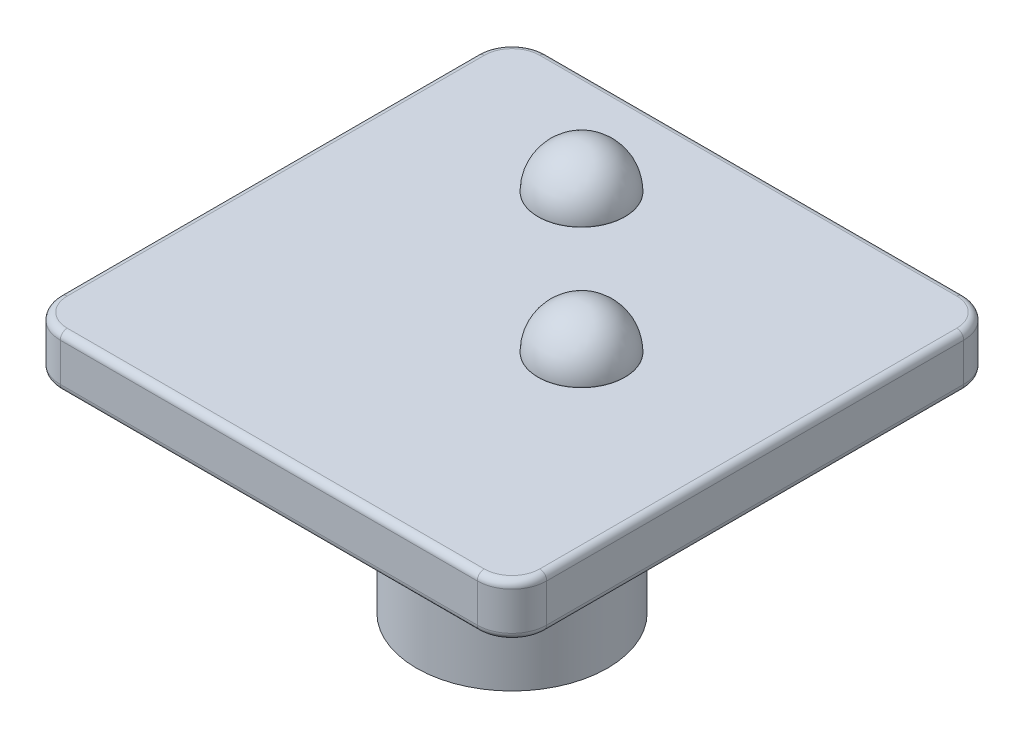
from build123d import *

# Parameters (mm, degrees)
BOSS_EXTRUDE1_DEPTH = 1.5
SKETCH2_R           = 2.75
BOSS_EXTRUDE2_DEPTH = 6
SKETCH3_W           = 1.1
SKETCH3_H           = 1.45
SKETCH3_W_2         = 1.45
SKETCH3_H_2         = 1.1
CUT_EXTRUDE1_DEPTH  = 6
CHAMFER1_SIZE       = 0.3
FILLET1_R           = 1
SKETCH4_R           = 1.25
BOSS_EXTRUDE3_DEPTH = 0.01
DOME1_FACE_RADIUS   = 1.25
DOME1_HEIGHT        = 1.25
DOME4_FACE_RADIUS   = 1.25
DOME4_HEIGHT        = 1.25
FILLET3_R           = 0.2


with BuildPart() as part:
    # Sketch1 → Boss-Extrude1 (new body)
    with BuildSketch(Plane(origin=(0, 0, 0), x_dir=(1, 0, 0), z_dir=(0, 1, 0))):
        with BuildLine():
            Line((-7.324675649, 4.396717546), (4.675324351, 4.396717546))
            ThreePointArc((4.675324351, 4.396717546), (5.382431132, 4.103824327), (5.675324351, 3.396717546))
            Line((5.675324351, 3.396717546), (5.675324351, -8.603282454))
            ThreePointArc((5.675324351, -8.603282454), (5.382431132, -9.310389235), (4.675324351, -9.603282454))
            Line((4.675324351, -9.603282454), (-7.324675649, -9.603282454))
            ThreePointArc((-7.324675649, -9.603282454), (-8.03178243, -9.310389235), (-8.324675649, -8.603282454))
            Line((-8.324675649, -8.603282454), (-8.324675649, 3.396717546))
            ThreePointArc((-8.324675649, 3.396717546), (-8.03178243, 4.103824327), (-7.324675649, 4.396717546))
        make_face()
    extrude(amount=BOSS_EXTRUDE1_DEPTH)

    # Sketch2 → Boss-Extrude2 (add)
    with BuildSketch(Plane.XZ):
        with Locations(Location((-1.324675649, 2.603282454, 0), (0, 0, 270))):
            Circle(SKETCH2_R)
    extrude(amount=BOSS_EXTRUDE2_DEPTH)

    # Sketch3 → Cut-Extrude1 (cut)
    with BuildSketch(Plane.XZ.offset(6)):
        with Locations((-1.324675649, 3.878282454)):
            Rectangle(SKETCH3_W, SKETCH3_H)
        with Locations((-0.049675649, 2.603282454)):
            Rectangle(SKETCH3_W_2, SKETCH3_H_2)
        with Locations((-1.324675649, 2.603282454)):
            Rectangle(SKETCH3_W, SKETCH3_H_2)
        with Locations((-2.599675649, 2.603282454)):
            Rectangle(SKETCH3_W_2, SKETCH3_H_2)
        with Locations((-1.324675649, 1.328282454)):
            Rectangle(SKETCH3_W, SKETCH3_H)
    extrude(amount=-CUT_EXTRUDE1_DEPTH, mode=Mode.SUBTRACT)

    # Chamfer1
    chamfer1_edges = [part.edges().sort_by_distance(p)[0] for p in [
        (-0.774675649, -6, 3.878282454),
        (-0.049675649, -6, 3.153282454),
        (0.675324351, -6, 2.603282454),
        (-0.774675649, -6, 1.328282454),
        (-2.599675649, -6, 3.153282454),
        (-1.324675649, -6, 4.603282454),
        (-1.874675649, -6, 3.878282454),
        (-3.324675649, -6, 2.603282454),
        (-2.599675649, -6, 2.053282454),
        (-1.874675649, -6, 1.328282454),
        (-1.324675649, -6, 0.603282454),
        (-0.049675649, -6, 2.053282454),
    ]]
    chamfer(chamfer1_edges, length=CHAMFER1_SIZE)

    # Fillet1
    fillet1_edges = [part.edges().sort_by_distance(p)[0] for p in [
        (-1.324675649, 0, 5.353282454),
    ]]
    fillet(fillet1_edges, radius=FILLET1_R)

    # Sketch4 → Boss-Extrude3 (add)
    with BuildSketch(Plane(origin=(0, 1.5, 0), x_dir=(1, 0, 0), z_dir=(0, 1, 0))):
        with Locations(Location((-3.324675649, 1.396717546, 0), (0, 0, 90))):
            Circle(SKETCH4_R)
        with Locations(Location((0.675324351, -2.603282454, 0), (0, 0, 90))):
            Circle(SKETCH4_R)
    extrude(amount=BOSS_EXTRUDE3_DEPTH)

    # Dome1: a dome of height H over a round flat face of radius A is a cap of a sphere of radius (A * A + H * H) / (2 * H)
    dome1_r = (DOME1_FACE_RADIUS * DOME1_FACE_RADIUS + DOME1_HEIGHT * DOME1_HEIGHT) / (2 * DOME1_HEIGHT)
    dome1_base = Plane((-3.324675649, 1.51, -1.396717546), z_dir=(0, 1, 0))
    with Locations(dome1_base.offset(DOME1_HEIGHT - dome1_r)):
        dome1_ball = Sphere(dome1_r, mode=Mode.PRIVATE)
    add(split(dome1_ball, bisect_by=dome1_base, keep=Keep.TOP, mode=Mode.PRIVATE))

    # Dome4: a dome of height H over a round flat face of radius A is a cap of a sphere of radius (A * A + H * H) / (2 * H)
    dome4_r = (DOME4_FACE_RADIUS * DOME4_FACE_RADIUS + DOME4_HEIGHT * DOME4_HEIGHT) / (2 * DOME4_HEIGHT)
    dome4_base = Plane((0.675324351, 1.51, 2.603282454), z_dir=(0, 1, 0))
    with Locations(dome4_base.offset(DOME4_HEIGHT - dome4_r)):
        dome4_ball = Sphere(dome4_r, mode=Mode.PRIVATE)
    add(split(dome4_ball, bisect_by=dome4_base, keep=Keep.TOP, mode=Mode.PRIVATE))

    # Fillet3
    fillet3_edges = [part.edges().sort_by_distance(p)[0] for p in [
        (5.382431132, 1.5, 9.310389235),
        (-1.324675649, 0, 9.603282454),
        (-8.03178243, 0, 9.310389235),
        (5.675324351, 1.5, 2.603282454),
        (5.382431132, 1.5, -4.103824327),
        (-1.324675649, 1.5, -4.396717546),
        (-8.03178243, 1.5, -4.103824327),
        (-8.324675649, 1.5, 2.603282454),
        (-8.03178243, 1.5, 9.310389235),
        (-1.324675649, 1.5, 9.603282454),
        (-8.324675649, 0, 2.603282454),
        (-8.03178243, 0, -4.103824327),
        (-1.324675649, 0, -4.396717546),
        (5.382431132, 0, -4.103824327),
        (5.675324351, 0, 2.603282454),
        (5.382431132, 0, 9.310389235),
    ]]
    fillet(fillet3_edges, radius=FILLET3_R)


solid = part.part
